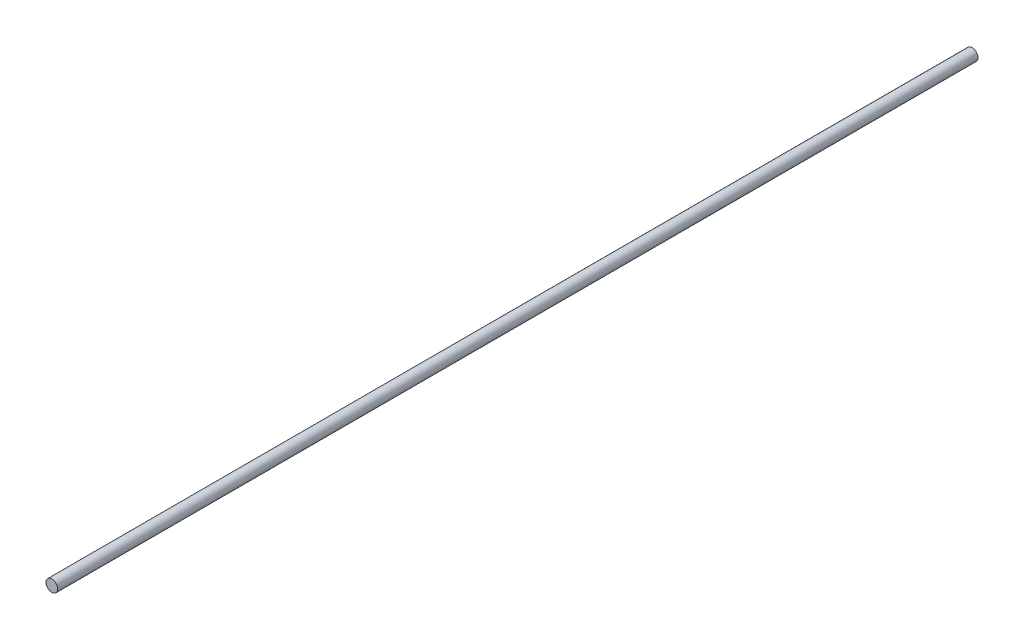
from build123d import *

# Parameters (mm, degrees)
CROQUIS1_R              = 3.175
SALIENTE_EXTRUIR1_DEPTH = 500


with BuildPart() as part:
    # Croquis1 → Saliente-Extruir1 (new body)
    with BuildSketch(Plane.XY):
        Circle(CROQUIS1_R)
    extrude(amount=SALIENTE_EXTRUIR1_DEPTH)


solid = part.part
